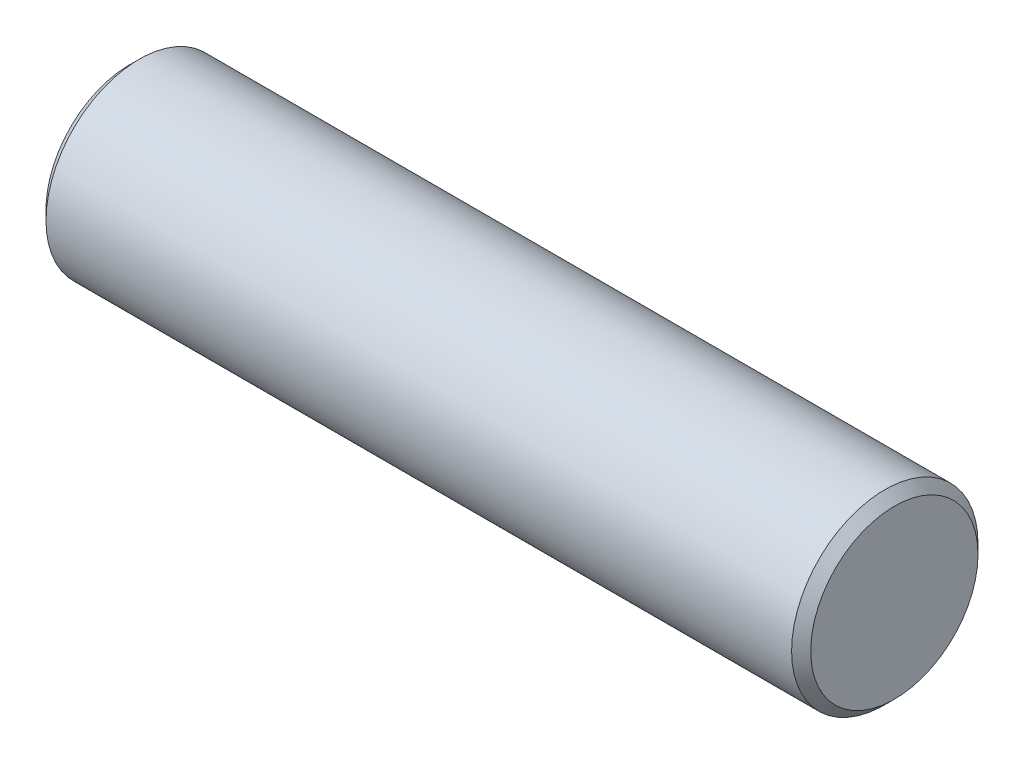
from build123d import *

# Parameters (mm, degrees)
SKETCH1_R           = 9.75
BOSS_EXTRUDE1_DEPTH = 80
CHAMFER1_SIZE       = 1


with BuildPart() as part:
    # Sketch1 → Boss-Extrude1 (new body)
    with BuildSketch(Plane(origin=(0, 0, 0), x_dir=(0, 0, -1), z_dir=(1, 0, 0))):
        Circle(SKETCH1_R)
    extrude(amount=BOSS_EXTRUDE1_DEPTH)

    # Chamfer1
    chamfer1_edges = [part.edges().sort_by_distance(p)[0] for p in [
        (80, 0, 9.75),
        (0, 0, 9.75),
    ]]
    chamfer(chamfer1_edges, length=CHAMFER1_SIZE)


solid = part.part
